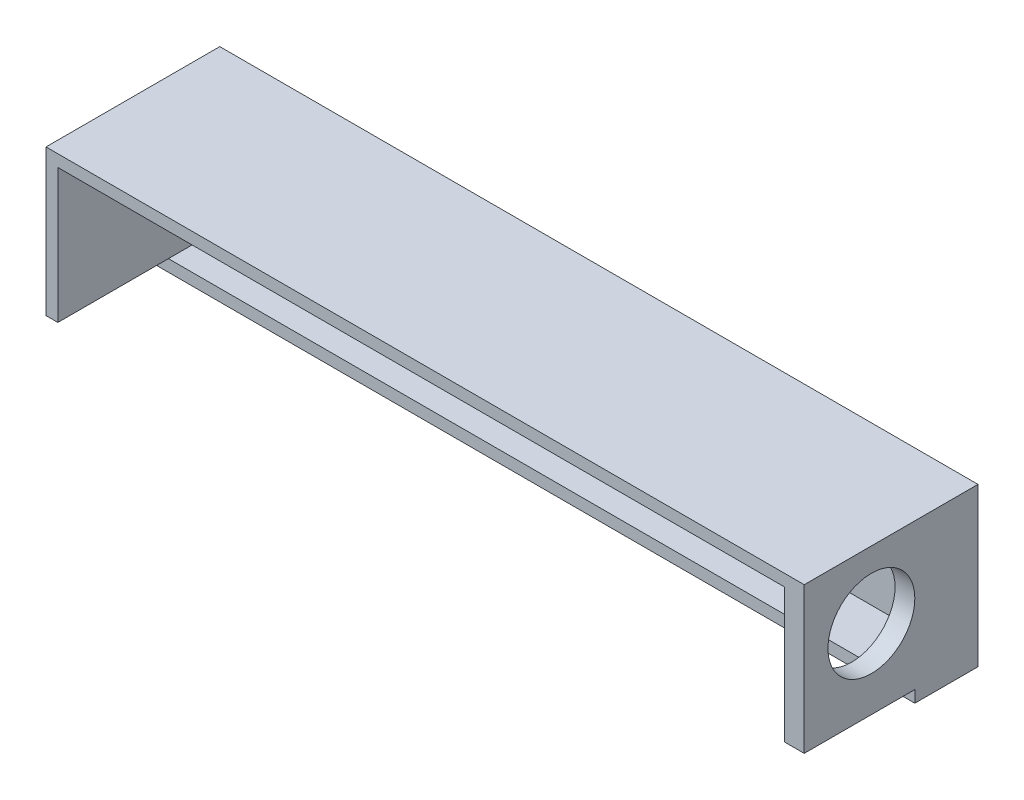
from build123d import *

# Parameters (mm, degrees)
SKETCH_1_W          = 93
SKETCH_1_H          = 20
EXTRUDE_1_DEPTH     = 1.5
SKETCH_2_W          = 93
SKETCH_2_H          = 20
SKETCH_2_W_2        = 89
SKETCH_2_H_2        = 17
EXTRUDE_2_DEPTH     = 20.5
SKETCH_3_W          = 14
SKETCH_3_H          = 1.5
CUT_EXTRUDE_1_DEPTH = 101.5
SKETCH_4_R          = 5.5
CUT_EXTRUDE_4_DEPTH = 3
EXTRUDE_3_DEPTH     = 3
SKETCH_7_W          = 3
SKETCH_7_H          = 17
CUT_EXTRUDE_6_DEPTH = 20.5


with BuildPart() as part:
    # Эскиз1 → Бобышка-Вытянуть1 (new body)
    with BuildSketch(Plane.XY):
        Rectangle(SKETCH_1_W, SKETCH_1_H)
    extrude(amount=EXTRUDE_1_DEPTH)

    # Эскиз2 → Бобышка-Вытянуть2 (add)
    with BuildSketch(Plane.XY.offset(1.5)):
        Rectangle(SKETCH_2_W, SKETCH_2_H)
        with Locations((-0.5, 0)):
            Rectangle(SKETCH_2_W_2, SKETCH_2_H_2, mode=Mode.SUBTRACT)
    extrude(amount=EXTRUDE_2_DEPTH)

    # Эскиз3 → Вырез-Вытянуть1 (cut)
    with BuildSketch(Plane(origin=(46.5, 0, 0), x_dir=(0, 0, -1), z_dir=(1, 0, 0))):
        with Locations((-15, -9.25)):
            Rectangle(SKETCH_3_W, SKETCH_3_H)
    extrude(amount=-CUT_EXTRUDE_1_DEPTH, mode=Mode.SUBTRACT)

    # Эскиз4 → Вырез-Вытянуть4 (cut)
    with BuildSketch(Plane(origin=(46.5, 0, 0), x_dir=(0, 0, -1), z_dir=(1, 0, 0))):
        with Locations((-13.5, 1.5)):
            Circle(SKETCH_4_R)
    extrude(amount=-CUT_EXTRUDE_4_DEPTH, mode=Mode.SUBTRACT)

    # Эскиз6 → Бобышка-Вытянуть3 (add)
    with BuildSketch(Plane.ZY.offset(46.5)):
        Polygon((0, 10), (22, 10), (22, -8.5), (8, -8.5), (8, -10), (0, -10), (0, -8.5), align=None)
    extrude(amount=EXTRUDE_3_DEPTH)

    # Эскиз7 → Вырез-Вытянуть6 (cut)
    with BuildSketch(Plane.XY.offset(22)):
        with Locations((-46.5, 0)):
            Rectangle(SKETCH_7_W, SKETCH_7_H)
    extrude(amount=-CUT_EXTRUDE_6_DEPTH, mode=Mode.SUBTRACT)


solid = part.part
